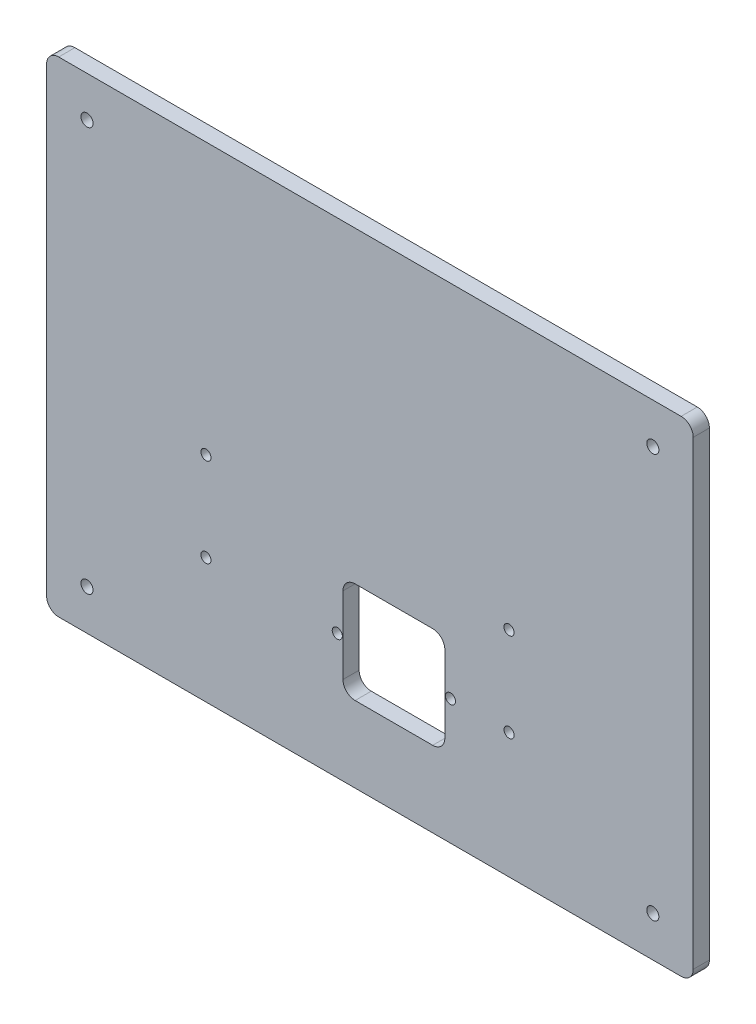
from build123d import *

# Parameters (mm, degrees)
SKETCH_1_W          = 95
SKETCH_1_H          = 120
EXTRUDE_1_DEPTH     = 4
FILLET_1_R          = 3
SKETCH_4_W          = 160
SKETCH_4_H          = 120
SKETCH_4_W_2        = 89
SKETCH_4_H_2        = 114
EXTRUDE_2_DEPTH     = 4
SKETCH_6_R          = 1.25
SKETCH_6_R_2        = 1.250834389
CUT_EXTRUDE_3_DEPTH = 101.480097532
SKETCH_7_W          = 25.2
SKETCH_7_H          = 25
CUT_EXTRUDE_4_DEPTH = 101.480097532
FILLET_3_R          = 3
SKETCH_8_R          = 1.5
CUT_EXTRUDE_5_DEPTH = 101.480097532


with BuildPart() as part:
    # 草图1 → 凸台-拉伸1 (new body)
    with BuildSketch(Plane.XY):
        Rectangle(SKETCH_1_W, SKETCH_1_H)
    extrude(amount=EXTRUDE_1_DEPTH)

    # 圆角1
    fillet_1_edges = [part.edges().sort_by_distance(p)[0] for p in [
        (-47.5, -60, 2),
        (-47.5, 60, 2),
        (47.5, 60, 2),
        (47.5, -60, 2),
    ]]
    fillet(fillet_1_edges, radius=FILLET_1_R)

    # 草图4 → 凸台-拉伸2 (add)
    with BuildSketch(Plane.XY.offset(4)):
        with Locations((-0.5, 0)):
            Rectangle(SKETCH_4_W, SKETCH_4_H)
        Rectangle(SKETCH_4_W_2, SKETCH_4_H_2, mode=Mode.SUBTRACT)
    extrude(amount=-EXTRUDE_2_DEPTH)

    # 草图6 → 切除-拉伸3 (cut, through all)
    with BuildSketch(Plane.XY.offset(4)):
        with Locations((19.425466369, -29.023426318)):
            Circle(SKETCH_6_R)
        with Locations((-8.574533631, -29.023426318)):
            Circle(SKETCH_6_R_2)
        with Locations((-41.074530224, -7.023426499)):
            Circle(SKETCH_6_R)
        with Locations((-41.074530224, -29.023426318)):
            Circle(SKETCH_6_R)
        with Locations((33.925469772, -29.023426318)):
            Circle(SKETCH_6_R)
        with Locations((33.925469772, -7.023426499)):
            Circle(SKETCH_6_R)
    extrude(amount=-CUT_EXTRUDE_3_DEPTH, mode=Mode.SUBTRACT)

    # 草图7 → 切除-拉伸4 (cut, through all)
    with BuildSketch(Plane(origin=(0, 0, 0), x_dir=(-1, 0, 0), z_dir=(0, 0, -1))):
        with Locations((-5.433347592, -28.724095143)):
            Rectangle(SKETCH_7_W, SKETCH_7_H)
    extrude(amount=-CUT_EXTRUDE_4_DEPTH, mode=Mode.SUBTRACT)

    # 圆角3
    fillet_3_edges = [part.edges().sort_by_distance(p)[0] for p in [
        (-7.166652408, -16.224095143, 2),
        (-7.166652408, -41.224095143, 2),
        (18.033347592, -41.224095143, 2),
        (18.033347592, -16.224095143, 2),
        (79.5, -60, 2),
        (-80.5, 60, 2),
        (-80.5, -60, 2),
        (79.5, 60, 2),
    ]]
    fillet(fillet_3_edges, radius=FILLET_3_R)

    # 草图8 → 切除-拉伸5 (cut, through all)
    with BuildSketch(Plane(origin=(0, 0, 0), x_dir=(-1, 0, 0), z_dir=(0, 0, -1))):
        with Locations((70.5, -50)):
            Circle(SKETCH_8_R)
        with Locations((70.5, 50)):
            Circle(SKETCH_8_R)
        with Locations((-69.5, 50)):
            Circle(SKETCH_8_R)
        with Locations((-69.5, -50)):
            Circle(SKETCH_8_R)
    extrude(amount=-CUT_EXTRUDE_5_DEPTH, mode=Mode.SUBTRACT)


solid = part.part
